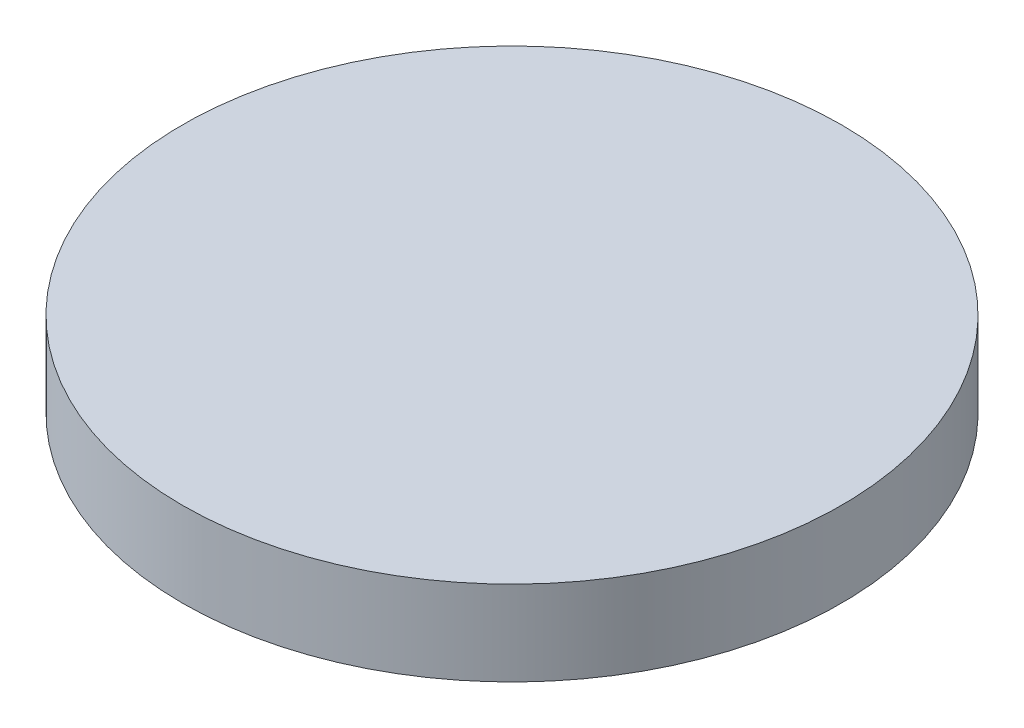
from build123d import *

# Parameters (mm, degrees)
SKETCH1_R             = 17.5
BOSS_EXTRUDE1_DEPTH   = 1.5
SKETCH3_W             = 1
SKETCH3_H             = 1.5
BOSS_EXTRUDE3_DEPTH   = 0.5
BOSS_EXTRUDE4_START   = 3
SKETCH3_4_R           = 17.5
BOSS_EXTRUDE4_DEPTH   = 3
BOSS_EXTRUDE6_DEPTH   = 2.5
BODY_MOVE_COPY1_ANGLE = 90


with BuildPart() as part:
    # Sketch1 → Boss-Extrude1 (new body)
    with BuildSketch(Plane(origin=(0, 0, 0), x_dir=(1, 0, 0), z_dir=(0, 1, 0))):
        with Locations(Location((0, 0, 0), (0, 0, 270))):
            Circle(SKETCH1_R)
    extrude(amount=BOSS_EXTRUDE1_DEPTH)

    # Sketch3 → Boss-Extrude3 (add)
    with BuildSketch(Plane.XZ):
        with Locations((0, 15.75)):
            Rectangle(SKETCH3_W, SKETCH3_H)
    extrude(amount=BOSS_EXTRUDE3_DEPTH)

    # Sketch3<4> → Boss-Extrude4 (add)
    with BuildSketch(Plane.XZ.offset(BOSS_EXTRUDE4_START)):
        with Locations(Location((0, 0, 0), (0, 0, 270))):
            Circle(SKETCH3_4_R)
        with BuildLine():
            Line((-0.5, 16.5), (0.5, 16.5))
            Line((0.5, 16.5), (0.5, 16.492422502))
            ThreePointArc((0.5, 16.492422502), (0, -16.5), (-0.5, 16.492422502))
            Line((-0.5, 16.492422502), (-0.5, 16.5))
        make_face(mode=Mode.SUBTRACT)
    extrude(amount=-BOSS_EXTRUDE4_DEPTH)

    # Sketch4 → Boss-Extrude6 (add)
    with BuildSketch(Plane.XZ.offset(3)):
        with BuildLine():
            Line((-0.5, 16.5), (-0.5, 16.492422502))
            ThreePointArc((-0.5, 16.492422502), (-0.250028708, 16.498105517), (0, 16.5))
            Line((0, 16.5), (-0.5, 16.5))
        make_face()
        with BuildLine():
            Line((0.5, 16.5), (0, 16.5))
            ThreePointArc((0, 16.5), (0.250028708, 16.498105517), (0.5, 16.492422502))
            Line((0.5, 16.492422502), (0.5, 16.5))
        make_face()
    extrude(amount=-BOSS_EXTRUDE6_DEPTH)

    # Split2
    split(bisect_by=Plane(origin=(0, 0, 0), x_dir=(-1, 0, 0), z_dir=(0, 0, -1)), keep=Keep.BOTTOM)

    # Mirror1: part across plane


with BuildPart() as part_1:
    add(part.part)
    add(part.part.mirror(Plane(origin=(0, 0, 0), x_dir=(1, 0, 0), z_dir=(0, 0, -1))))


with BuildPart() as body_2:
    # Body-Move/Copy1: copy of part
    add(part_1.part.rotate(Axis((0, 0, 0), (0, 1, 0)), BODY_MOVE_COPY1_ANGLE))


with BuildPart() as part_2:
    add(part_1.part)

    # Combine1: union body 2
    add(body_2.part)


solid = part_2.part
